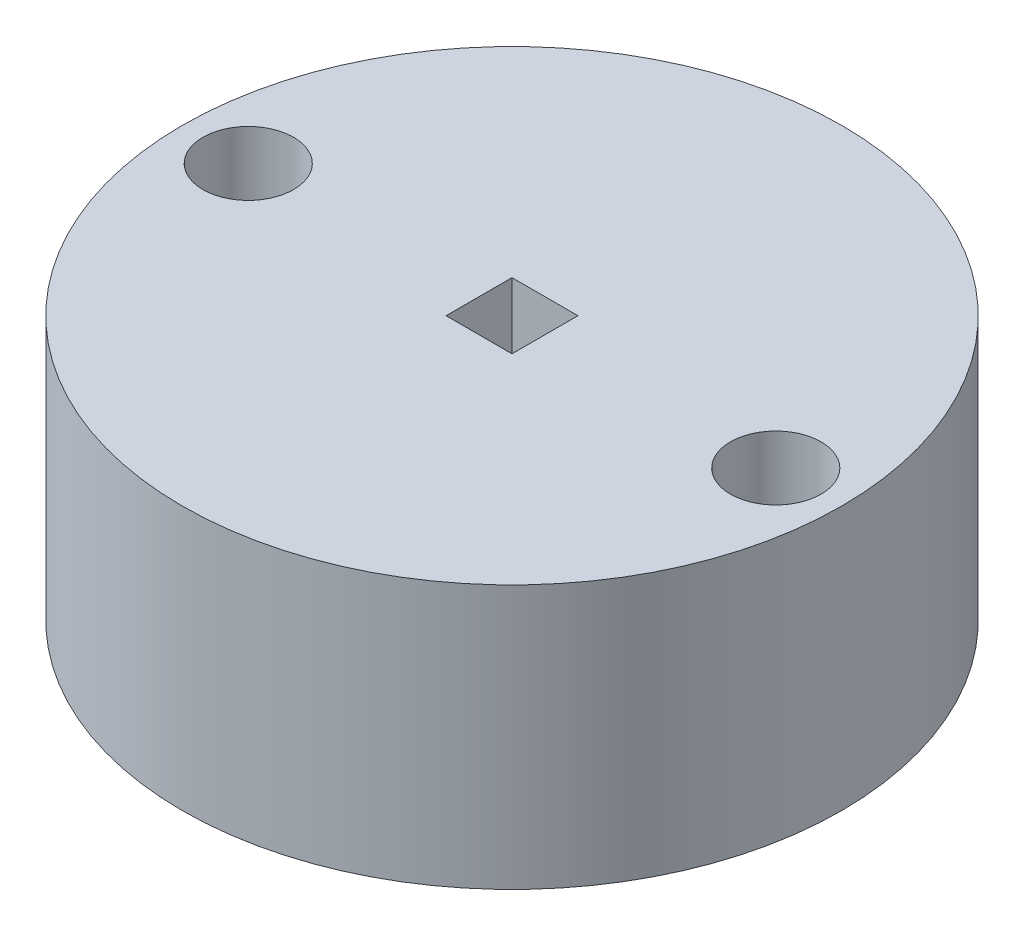
from build123d import *

# Parameters (mm, degrees)
SKETCH1_R           = 15.875
SKETCH1_R_2         = 2.1828125
SKETCH1_W           = 3.175
SKETCH1_H           = 3.175
BOSS_EXTRUDE1_DEPTH = 12.7


with BuildPart() as part:
    # Sketch1 → Boss-Extrude1 (new body)
    with BuildSketch(Plane(origin=(0, 0, 0), x_dir=(1, 0, 0), z_dir=(0, 1, 0))):
        with Locations(Location((0, 0, 0), (0, 0, 270))):
            Circle(SKETCH1_R)
        with Locations(Location((12.7, 0, 0), (0, 0, 270))):
            Circle(SKETCH1_R_2, mode=Mode.SUBTRACT)
        with Locations(Location((-12.7, 0, 0), (0, 0, 270))):
            Circle(SKETCH1_R_2, mode=Mode.SUBTRACT)
        Rectangle(SKETCH1_W, SKETCH1_H, mode=Mode.SUBTRACT)
    extrude(amount=BOSS_EXTRUDE1_DEPTH)


solid = part.part
